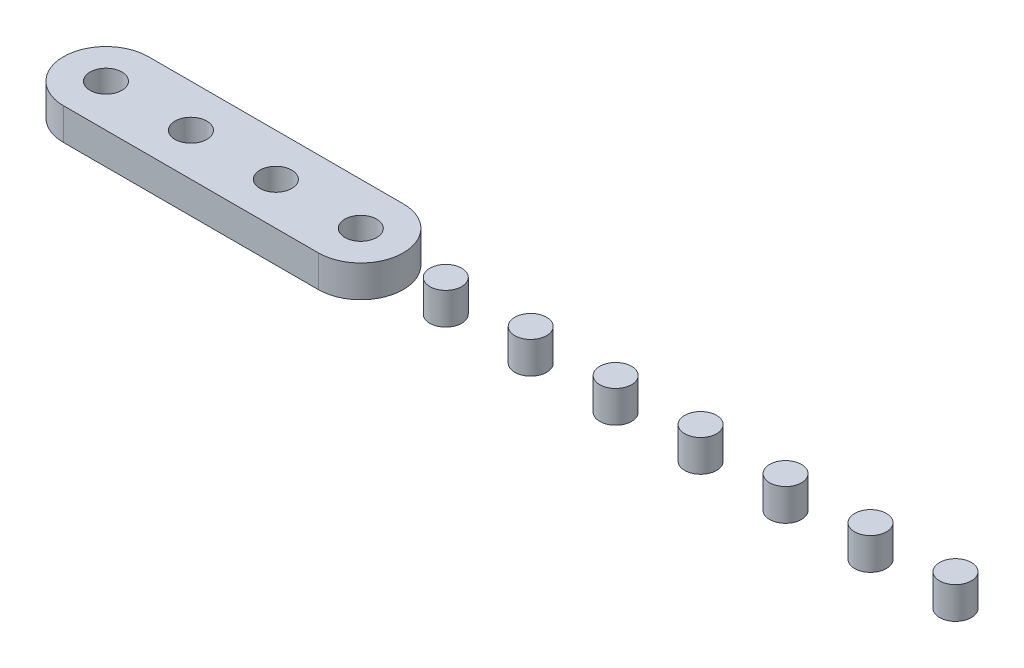
from build123d import *

# Parameters (mm, degrees)
SKETCH2_R             = 1.5
BOSS_EXTRUDE2_DEPTH   = 3
BOSS_EXTRUDE2_2_DEPTH = 3
BOSS_EXTRUDE2_3_DEPTH = 3
BOSS_EXTRUDE2_4_DEPTH = 3
BOSS_EXTRUDE2_5_DEPTH = 3
BOSS_EXTRUDE2_6_DEPTH = 3
BOSS_EXTRUDE2_7_DEPTH = 3
BOSS_EXTRUDE2_8_DEPTH = 3


with BuildPart() as part:
    # Sketch2 → Boss-Extrude2 (new body)
    with BuildSketch(Plane(origin=(0, 0, 0), x_dir=(1, 0, 0), z_dir=(0, 1, 0))):
        with Locations(Location((32, 0, 0), (0, 0, 270))):
            Circle(SKETCH2_R)
    extrude(amount=BOSS_EXTRUDE2_DEPTH)


with BuildPart() as body_2:
    # Sketch2 → Boss-Extrude2 2 (new body)
    with BuildSketch(Plane(origin=(0, 0, 0), x_dir=(1, 0, 0), z_dir=(0, 1, 0))):
        with Locations(Location((40, 0, 0), (0, 0, 270))):
            Circle(SKETCH2_R)
    extrude(amount=BOSS_EXTRUDE2_2_DEPTH)


with BuildPart() as body_3:
    # Sketch2 → Boss-Extrude2 3 (new body)
    with BuildSketch(Plane(origin=(0, 0, 0), x_dir=(1, 0, 0), z_dir=(0, 1, 0))):
        with Locations(Location((48, 0, 0), (0, 0, 270))):
            Circle(SKETCH2_R)
    extrude(amount=BOSS_EXTRUDE2_3_DEPTH)


with BuildPart() as body_4:
    # Sketch2 → Boss-Extrude2 4 (new body)
    with BuildSketch(Plane(origin=(0, 0, 0), x_dir=(1, 0, 0), z_dir=(0, 1, 0))):
        with Locations(Location((56, 0, 0), (0, 0, 270))):
            Circle(SKETCH2_R)
    extrude(amount=BOSS_EXTRUDE2_4_DEPTH)


with BuildPart() as body_5:
    # Sketch2 → Boss-Extrude2 5 (new body)
    with BuildSketch(Plane(origin=(0, 0, 0), x_dir=(1, 0, 0), z_dir=(0, 1, 0))):
        with Locations(Location((64, 0, 0), (0, 0, 270))):
            Circle(SKETCH2_R)
    extrude(amount=BOSS_EXTRUDE2_5_DEPTH)


with BuildPart() as body_6:
    # Sketch2 → Boss-Extrude2 6 (new body)
    with BuildSketch(Plane(origin=(0, 0, 0), x_dir=(1, 0, 0), z_dir=(0, 1, 0))):
        with Locations(Location((72, 0, 0), (0, 0, 270))):
            Circle(SKETCH2_R)
    extrude(amount=BOSS_EXTRUDE2_6_DEPTH)


with BuildPart() as body_7:
    # Sketch2 → Boss-Extrude2 7 (new body)
    with BuildSketch(Plane(origin=(0, 0, 0), x_dir=(1, 0, 0), z_dir=(0, 1, 0))):
        with Locations(Location((80, 0, 0), (0, 0, 270))):
            Circle(SKETCH2_R)
    extrude(amount=BOSS_EXTRUDE2_7_DEPTH)


with BuildPart() as body_8:
    # Sketch2 → Boss-Extrude2 8 (new body)
    with BuildSketch(Plane(origin=(0, 0, 0), x_dir=(1, 0, 0), z_dir=(0, 1, 0))):
        with BuildLine():
            Line((0, 4), (24, 4))
            ThreePointArc((24, 4), (28, 0), (24, -4))
            Line((24, -4), (0, -4))
            ThreePointArc((0, -4), (-4, 0), (0, 4))
        make_face()
        with Locations(Location((0, 0, 0), (0, 0, 270))):
            Circle(SKETCH2_R, mode=Mode.SUBTRACT)
        with Locations(Location((8, 0, 0), (0, 0, 270))):
            Circle(SKETCH2_R, mode=Mode.SUBTRACT)
        with Locations(Location((16, 0, 0), (0, 0, 270))):
            Circle(SKETCH2_R, mode=Mode.SUBTRACT)
        with Locations(Location((24, 0, 0), (0, 0, 270))):
            Circle(SKETCH2_R, mode=Mode.SUBTRACT)
    extrude(amount=BOSS_EXTRUDE2_8_DEPTH)


solid = Compound([part.part, body_2.part, body_3.part, body_4.part, body_5.part, body_6.part, body_7.part, body_8.part])
